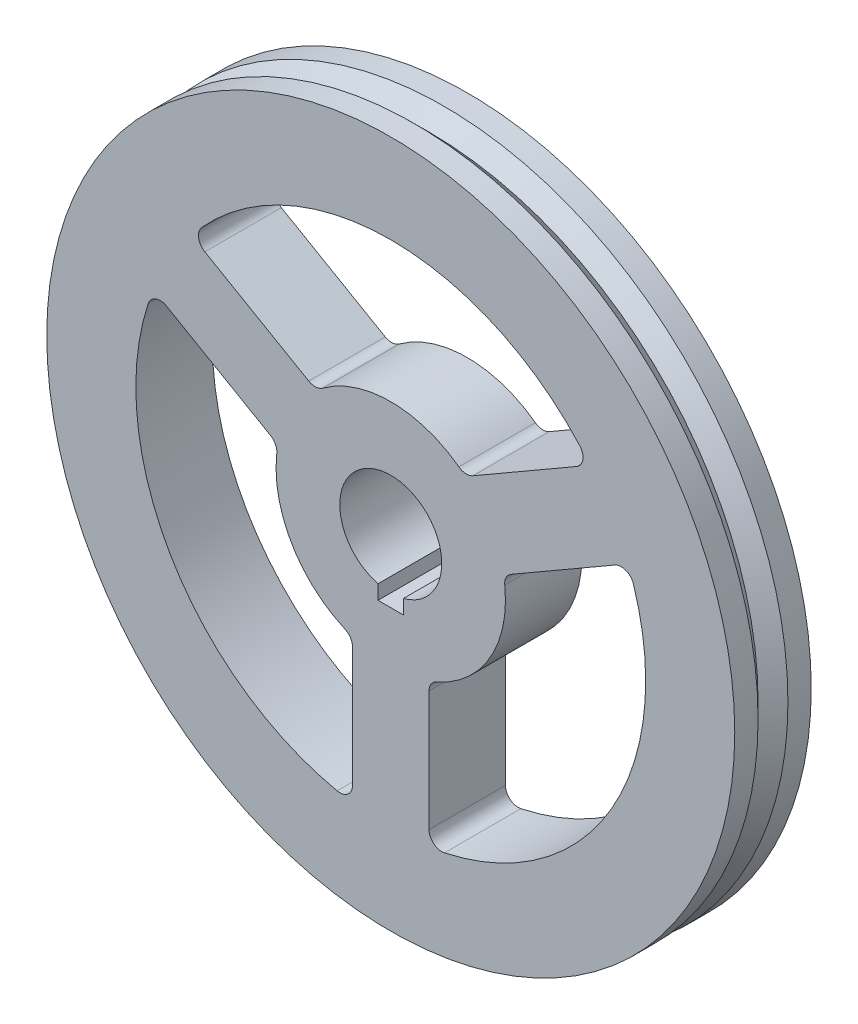
from build123d import *

# Parameters (mm, degrees)
SKETCH1_R           = 125
SKETCH1_R_2         = 20
BOSS_EXTRUDE1_DEPTH = 30
CUT_EXTRUDE1_REACH  = 181.304
SKETCH2_W           = 10
SKETCH2_H           = 10


with BuildPart() as part:
    # Sketch1 → Boss-Extrude1 (new body)
    with BuildSketch(Plane.XY):
        Circle(SKETCH1_R)
        Circle(SKETCH1_R_2, mode=Mode.SUBTRACT)
        with BuildLine():
            Line((-15, -45.82575695), (-15, -92.870878105))
            ThreePointArc((-15, -92.870878105), (-16.858595688, -96.760811131), (-21.052631579, -97.758819058))
            ThreePointArc((-21.052631579, -97.758819058), (-86.602540378, -50), (-95.187936538, 30.647295765))
            ThreePointArc((-95.187936538, 30.647295765), (-92.226618374, 33.780433428), (-87.928539711, 33.445057996))
            Line((-87.928539711, 33.445057996), (-47.186269666, 9.922497418))
            ThreePointArc((-47.186269666, 9.922497418), (-45.222911355, 7.845908192), (-44.717642699, 5.033133359))
            ThreePointArc((-44.717642699, 5.033133359), (-38.97114317, -22.5), (-18, -41.243181255))
            ThreePointArc((-18, -41.243181255), (-15.816699867, -43.087144162), (-15, -45.82575695))
        make_face(mode=Mode.SUBTRACT)
        with BuildLine():
            Line((15, -45.82575695), (15, -92.870878105))
            ThreePointArc((15, -92.870878105), (16.858595688, -96.760811131), (21.052631579, -97.758819058))
            ThreePointArc((21.052631579, -97.758819058), (86.602540378, -50), (95.187936538, 30.647295765))
            ThreePointArc((95.187936538, 30.647295765), (92.226618374, 33.780433428), (87.928539711, 33.445057996))
            Line((87.928539711, 33.445057996), (47.186269666, 9.922497418))
            ThreePointArc((47.186269666, 9.922497418), (45.222911355, 7.845908192), (44.717642699, 5.033133359))
            ThreePointArc((44.717642699, 5.033133359), (38.97114317, -22.5), (18, -41.243181255))
            ThreePointArc((18, -41.243181255), (15.816699867, -43.087144162), (15, -45.82575695))
        make_face(mode=Mode.SUBTRACT)
        with BuildLine():
            Line((-32.186269666, 35.903259532), (-72.928539711, 59.425820109))
            ThreePointArc((-72.928539711, 59.425820109), (-75.368022686, 62.980377703), (-74.135304959, 67.111523293))
            ThreePointArc((-74.135304959, 67.111523293), (0, 100), (74.135304959, 67.111523293))
            ThreePointArc((74.135304959, 67.111523293), (75.368022686, 62.980377703), (72.928539711, 59.425820109))
            Line((72.928539711, 59.425820109), (32.186269666, 35.903259532))
            ThreePointArc((32.186269666, 35.903259532), (29.406211487, 35.24123597), (26.717642699, 36.210047895))
            ThreePointArc((26.717642699, 36.210047895), (0, 45), (-26.717642699, 36.210047895))
            ThreePointArc((-26.717642699, 36.210047895), (-29.406211487, 35.24123597), (-32.186269666, 35.903259532))
        make_face(mode=Mode.SUBTRACT)
    extrude(amount=BOSS_EXTRUDE1_DEPTH)

    # Sketch2 → Cut-Extrude1 (cut, up to next)
    with BuildSketch(Plane.XY.offset(30), mode=Mode.PRIVATE) as cut_extrude1_sk1:
        with Locations((0, -20)):
            Rectangle(SKETCH2_W, SKETCH2_H)
    cut_extrude1_tool1 = extrude(cut_extrude1_sk1.sketch, amount=-CUT_EXTRUDE1_REACH, mode=Mode.PRIVATE) & part.part
    add(cut_extrude1_tool1.solids().sort_by_distance((0, -20, 30))[0], mode=Mode.SUBTRACT)

    # Sketch3 → Revolve-Thin1 (revolve)
    with BuildSketch(Plane(origin=(0, 0, 0), x_dir=(0, 0, -1), z_dir=(1, 0, 0)), mode=Mode.PRIVATE) as revolve_thin1_sk:
        Polygon((-30, 124.946096873), (-25, 124.946096873), (-15, 114.946096873), (-5, 124.946096873), (0, 124.946096873), (0, 134.946096873), (-9.142135624, 134.946096873), (-15, 129.088232497), (-20.857864376, 134.946096873), (-30, 134.946096873), align=None)
    revolve(revolve_thin1_sk.sketch.rotate(Axis((0, 0, -10.871805442), (0, 0, 1)), 90), axis=Axis((0, 0, -10.871805442), (0, 0, 1)))


solid = part.part
